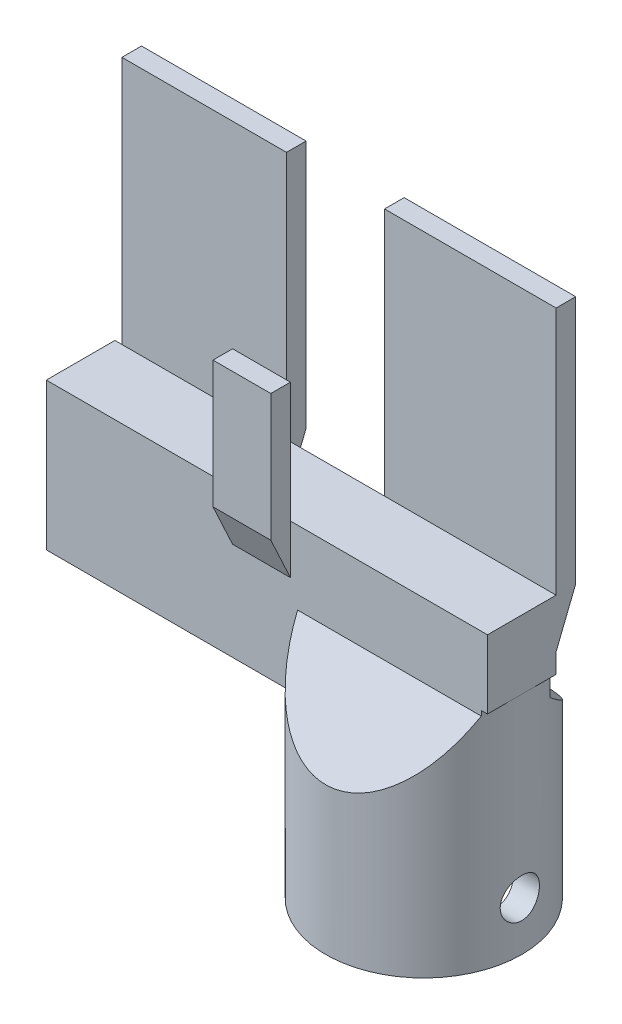
from build123d import *

# Parameters (mm, degrees)
SKETCH2_R               = 10
BOSS_EXTRUDE1_DEPTH     = 30
CUT_EXTRUDE1_START      = -10
SKETCH3_R               = 10
SKETCH3_R_2             = 7.5
CUT_EXTRUDE1_DEPTH      = 10
CUT_EXTRUDE3_DEPTH      = 10
CUT_EXTRUDE3_DEPTH_BACK = 10
SKETCH5_R               = 2
FILLET2_R               = 10
BOSS_EXTRUDE2_START     = -67.5
SKETCH7_R               = 10
BOSS_EXTRUDE2_DEPTH     = 67.5
SKETCH8_R               = 50
SKETCH8_R_2             = 10
CUT_EXTRUDE6_DEPTH      = 107.770782567
SKETCH9_R               = 7.5
CUT_EXTRUDE7_DEPTH      = 10
CUT_EXTRUDE8_DEPTH      = 10
CUT_EXTRUDE8_DEPTH_BACK = 10
SKETCH10_R              = 2
CUT_EXTRUDE9_DEPTH      = 48
CUT_EXTRUDE9_DEPTH_BACK = 29
SKETCH12_W              = 23.028444079
SKETCH12_H              = 65
SKETCH13_W              = 45
SKETCH13_H              = 7
BOSS_EXTRUDE3_DEPTH     = 15
SKETCH14_W              = 7
SKETCH14_H              = 25.920736851
BOSS_EXTRUDE4_DEPTH     = 2
SKETCH15_W              = 17.5
SKETCH15_H              = 25.366229316
BOSS_EXTRUDE5_DEPTH     = 2
SKETCH15_W_2            = 16.786959534
BOSS_EXTRUDE5_2_DEPTH   = 2
BOSS_EXTRUDE6_START     = -44.28696
BOSS_EXTRUDE6_DEPTH     = 44.28696
SKETCH17_W              = 10
SKETCH17_H              = 2
SKETCH17_W_2            = 18.286959534
SKETCH17_W_3            = 19
CUT_EXTRUDE10_DEPTH     = 8
BOSS_EXTRUDE7_DEPTH     = 19.367497
CUT_EXTRUDE11_DEPTH     = 8
SKETCH22_W              = 1.1
SKETCH22_H              = 2
CUT_EXTRUDE12_DEPTH     = 32
SKETCH23_W              = 5.9
SKETCH23_H              = 12.960368426
CUT_EXTRUDE13_DEPTH     = 10


with BuildPart() as part:
    # Sketch1 → Revolve1 (revolve)
    with BuildSketch(Plane.XY):
        Polygon((50, 25), (0, 25), (0, 22.5), (45, 22.5), (45, -22.5), (0, -22.5), (0, -25), (50, -25), align=None)
    revolve(axis=Axis((0, -25, 0), (0, 1, 0)))

    # Sketch2 → Boss-Extrude1 (add)
    with BuildSketch(Plane(origin=(0, 25, 0), x_dir=(1, 0, 0), z_dir=(0, 1, 0))):
        with Locations(Location((0, 0, 0), (0, 0, 180))):
            Circle(SKETCH2_R)
    extrude(amount=BOSS_EXTRUDE1_DEPTH)

    # Sketch3 → Cut-Extrude1 (cut)
    with BuildSketch(Plane(origin=(0, 55, 0), x_dir=(1, 0, 0), z_dir=(0, 1, 0)).offset(CUT_EXTRUDE1_START)):
        with Locations(Location((0, 0, 0), (0, 0, 180))):
            Circle(SKETCH3_R)
        with Locations(Location((0, 0, 0), (0, 0, 180))):
            Circle(SKETCH3_R_2, mode=Mode.SUBTRACT)
    extrude(amount=CUT_EXTRUDE1_DEPTH, mode=Mode.SUBTRACT)

    # Sketch5 → Cut-Extrude3 (cut, two sides: drawn at the far end of the back side and taken through both)
    with BuildSketch(Plane(origin=(0, 0, 0), x_dir=(0, 0, -1), z_dir=(1, 0, 0)).offset(-CUT_EXTRUDE3_DEPTH_BACK)):
        with Locations(Location((0, 50, 0), (0, 0, 180))):
            Circle(SKETCH5_R)
    extrude(amount=CUT_EXTRUDE3_DEPTH + CUT_EXTRUDE3_DEPTH_BACK, mode=Mode.SUBTRACT)

    # Fillet2
    fillet2_edges = [part.edges().sort_by_distance(p)[0] for p in [
        (-50, 25, 0),
    ]]
    fillet(fillet2_edges, radius=FILLET2_R)

    # Sketch7 → Boss-Extrude2 (add)
    with BuildSketch(Plane(origin=(0, 45, 0), x_dir=(1, 0, 0), z_dir=(0, 1, 0)).offset(BOSS_EXTRUDE2_START)):
        with Locations(Location((0, 0, 0), (0, 0, 180))):
            Circle(SKETCH7_R)
    extrude(amount=BOSS_EXTRUDE2_DEPTH)

    # Sketch8 → Cut-Extrude6 (cut, through all)
    with BuildSketch(Plane(origin=(0, 55, 0), x_dir=(1, 0, 0), z_dir=(0, 1, 0))):
        Circle(SKETCH8_R)
        with Locations(Location((0, 0, 0), (0, 0, 180))):
            Circle(SKETCH8_R_2, mode=Mode.SUBTRACT)
    extrude(amount=-CUT_EXTRUDE6_DEPTH, mode=Mode.SUBTRACT)

    # Sketch9 → Cut-Extrude7 (cut)
    with BuildSketch(Plane.XZ.offset(25)):
        with Locations(Location((0, 0, 0), (0, 0, 180))):
            Circle(SKETCH9_R)
    extrude(amount=-CUT_EXTRUDE7_DEPTH, mode=Mode.SUBTRACT)

    # Sketch10 → Cut-Extrude8 (cut, two sides: drawn at the far end of the back side and taken through both)
    with BuildSketch(Plane(origin=(0, 0, 0), x_dir=(0, 0, -1), z_dir=(1, 0, 0)).offset(-CUT_EXTRUDE8_DEPTH_BACK)):
        with Locations(Location((0, -20, 0), (0, 0, 180))):
            Circle(SKETCH10_R)
    extrude(amount=CUT_EXTRUDE8_DEPTH + CUT_EXTRUDE8_DEPTH_BACK, mode=Mode.SUBTRACT)

    # Sketch12 → Cut-Extrude9 (cut, two sides: drawn at the far end of the back side and taken through both)
    with BuildSketch(Plane(origin=(0, 0, 0), x_dir=(0, 0, -1), z_dir=(1, 0, 0)).offset(-CUT_EXTRUDE9_DEPTH_BACK)):
        with Locations((0.475794299, 22.5)):
            Rectangle(SKETCH12_W, SKETCH12_H)
    extrude(amount=CUT_EXTRUDE9_DEPTH + CUT_EXTRUDE9_DEPTH_BACK, mode=Mode.SUBTRACT)

    # Sketch13 → Boss-Extrude3 (add)
    with BuildSketch(Plane(origin=(0, -10, 0), x_dir=(1, 0, 0), z_dir=(0, 1, 0))):
        with Locations((-12.5, 0)):
            Rectangle(SKETCH13_W, SKETCH13_H)
    extrude(amount=BOSS_EXTRUDE3_DEPTH)

    # Sketch14 → Boss-Extrude4 (add)
    with BuildSketch(Plane.XY.offset(3.5)):
        with Locations((-12.5, 17.264610389)):
            Rectangle(SKETCH14_W, SKETCH14_H)
    extrude(amount=BOSS_EXTRUDE4_DEPTH)



with BuildPart() as body_2:
    # Sketch15 → Boss-Extrude5 (new body)
    with BuildSketch(Plane(origin=(0, 0, -3.5), x_dir=(-1, 0, 0), z_dir=(0, 0, -1))):
        with Locations((-1.25, 17.683114658)):
            Rectangle(SKETCH15_W, SKETCH15_H)
    extrude(amount=BOSS_EXTRUDE5_DEPTH)


with BuildPart() as body_3:
    # Sketch15 → Boss-Extrude5 2 (new body)
    with BuildSketch(Plane(origin=(0, 0, -3.5), x_dir=(-1, 0, 0), z_dir=(0, 0, -1))):
        with Locations((25.893479767, 17.683114658)):
            Rectangle(SKETCH15_W_2, SKETCH15_H)
    extrude(amount=BOSS_EXTRUDE5_2_DEPTH)


with BuildPart() as part_1:
    add(part.part)

    add(body_2.part)  # Boss-Extrude6 merges body 2

    add(body_3.part)  # Boss-Extrude6 merges body 3
    # Sketch16 → Boss-Extrude6 (add)
    with BuildSketch(Plane.ZY.offset(34.286959534).offset(BOSS_EXTRUDE6_START)):
        Polygon((-5.5, 5), (-3.5, 0), (-3.5, 5), align=None)
        Polygon((3.5, 0), (5.5, 4.304241963), (3.5, 4.304241963), align=None)
    extrude(amount=BOSS_EXTRUDE6_DEPTH)

    # Sketch17 → Cut-Extrude10 (cut)
    with BuildSketch(Plane(origin=(0, 5, 0), x_dir=(1, 0, 0), z_dir=(0, 1, 0))):
        with Locations((-12.5, 4.5)):
            Rectangle(SKETCH17_W, SKETCH17_H)
        with Locations((-25.143479767, -4.5)):
            Rectangle(SKETCH17_W_2, SKETCH17_H)
        with Locations((0.5, -4.5)):
            Rectangle(SKETCH17_W_3, SKETCH17_H)
    extrude(amount=-CUT_EXTRUDE10_DEPTH, mode=Mode.SUBTRACT)

    # Sketch18 → Boss-Extrude7 (add)
    with BuildSketch(Plane(origin=(10, 0, 0), x_dir=(0, 0, -1), z_dir=(1, 0, 0))):
        Polygon((-10, -10), (-3.5, -10), (-3.5, -2.5), align=None)
        Polygon((10, -10), (3.5, -4.366666667), (3.5, -10), align=None)
    extrude(amount=-BOSS_EXTRUDE7_DEPTH)

    # Sketch19 → Cut-Extrude11 (cut)
    with BuildSketch(Plane.XZ.offset(10)):
        with BuildLine():
            ThreePointArc((0, 10), (7.071067812, 7.071067812), (10, 0))
            Line((10, 0), (10, 10))
            Line((10, 10), (0, 10))
        make_face()
        with BuildLine():
            Line((-13.702189606, 3.5), (-9.367496998, 3.5))
            ThreePointArc((-9.367496998, 3.5), (-5.700877125, 8.215838363), (0, 10))
            Line((0, 10), (10, 10))
            ThreePointArc((10, 10), (-3.740194109, 13.638583065), (-13.702189606, 3.5))
        make_face()
        with BuildLine():
            ThreePointArc((10, 0), (1.778346145, -9.840603893), (-9.367496998, -3.5))
            Line((-9.367496998, -3.5), (-13.702189606, -3.5))
            ThreePointArc((-13.702189606, -3.5), (6.999217954, -12.288651188), (10, 10))
            Line((10, 10), (10, 0))
        make_face()
    extrude(amount=-CUT_EXTRUDE11_DEPTH, mode=Mode.SUBTRACT)

    # Sketch22 → Cut-Extrude12 (cut)
    with BuildSketch(Plane(origin=(0, 30.224978814, 0), x_dir=(1, 0, 0), z_dir=(0, 1, 0))):
        with Locations((-9.55, -4.5)):
            Rectangle(SKETCH22_W, SKETCH22_H)
    extrude(amount=-CUT_EXTRUDE12_DEPTH, mode=Mode.SUBTRACT)

    # Sketch23 → Cut-Extrude13 (cut)
    with BuildSketch(Plane.XY.offset(5.5)):
        with Locations((-13.05, 23.744794601)):
            Rectangle(SKETCH23_W, SKETCH23_H)
    extrude(amount=-CUT_EXTRUDE13_DEPTH, mode=Mode.SUBTRACT)


solid = part_1.part
